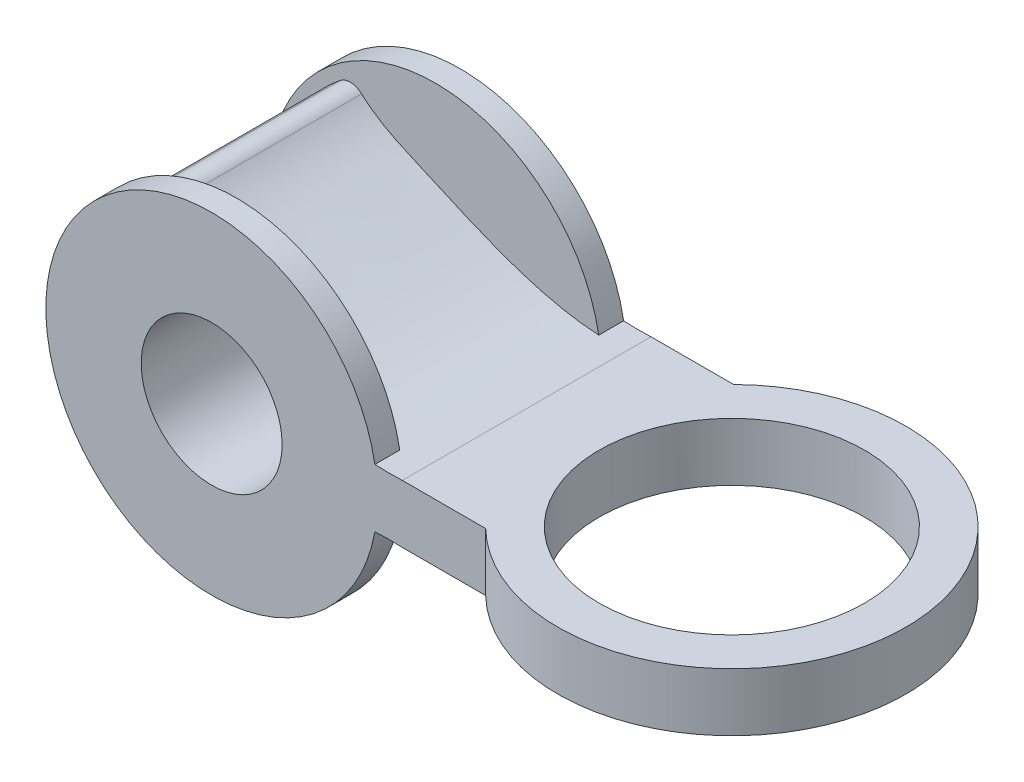
from build123d import *

# Parameters (mm, degrees)
SKETCH1_R           = 20
BOSS_EXTRUDE1_DEPTH = 3
BOSS_EXTRUDE2_DEPTH = 30
FILLET1_R           = 2
SKETCH3_R           = 21
BOSS_EXTRUDE3_DEPTH = 7
BOSS_EXTRUDE4_START = -3
SKETCH4_R           = 20
BOSS_EXTRUDE4_DEPTH = 3
SKETCH5_R           = 8.5
CUT_EXTRUDE1_DEPTH  = 43
SKETCH6_R           = 16
CUT_EXTRUDE2_DEPTH  = 43


with BuildPart() as part:
    # Sketch1 → Boss-Extrude1 (new body)
    with BuildSketch(Plane.XY):
        Circle(SKETCH1_R)
    extrude(amount=-BOSS_EXTRUDE1_DEPTH)

    # Sketch2 → Boss-Extrude2 (add)
    with BuildSketch(Plane.XY):
        with BuildLine():
            Line((22.995189637, 3.5), (35.372983102, 3.5))
            Line((35.372983102, 3.5), (35.372983102, -3.5))
            Line((35.372983102, -3.5), (22.995189637, -3.5))
            add(Edge.make_bspline(
                [(-10.012259603, -15.596019766), (-7.820118135, -12.904569359), (3.188583593, -8.31405085), (13.833155486, -3.052585892), (22.995189637, -3.5)],
                knots=[0, 0, 0, 0, 0.276488418, 1, 1, 1, 1], degree=3))
            ThreePointArc((-10.012259603, -15.596019766), (-18.533245126, 0), (-10.012259603, 15.596019766))
            add(Edge.make_bspline(
                [(-10.012259603, 15.596019766), (-7.820118135, 12.904569359), (3.188583593, 8.31405085), (13.833155486, 3.052585892), (22.995189637, 3.5)],
                knots=[0, 0, 0, 0, 0.276488418, 1, 1, 1, 1], degree=3))
        make_face()
    extrude(amount=-BOSS_EXTRUDE2_DEPTH)

    # Fillet1
    fillet1_edges = [part.edges().sort_by_distance(p)[0] for p in [
        (-10.012259603, 15.596019766, -16.5),
        (-10.012259603, -15.596019766, -16.5),
    ]]
    fillet(fillet1_edges, radius=FILLET1_R)

    # Sketch3 → Boss-Extrude3 (add)
    with BuildSketch(Plane.XZ.offset(3.5)):
        with Locations((47.699784797, -15.04571332)):
            Circle(SKETCH3_R)
    extrude(amount=-BOSS_EXTRUDE3_DEPTH)

    # Sketch4 → Boss-Extrude4 (add)
    with BuildSketch(Plane(origin=(0, 0, -30), x_dir=(-1, 0, 0), z_dir=(0, 0, -1)).offset(BOSS_EXTRUDE4_START)):
        Circle(SKETCH4_R)
    extrude(amount=BOSS_EXTRUDE4_DEPTH)

    # Sketch5 → Cut-Extrude1 (cut)
    with BuildSketch(Plane.XY):
        Circle(SKETCH5_R)
    extrude(amount=-CUT_EXTRUDE1_DEPTH, mode=Mode.SUBTRACT)

    # Sketch6 → Cut-Extrude2 (cut)
    with BuildSketch(Plane.XZ.offset(3.5)):
        with Locations((47.699784797, -15.04571332)):
            Circle(SKETCH6_R)
    extrude(amount=-CUT_EXTRUDE2_DEPTH, mode=Mode.SUBTRACT)


solid = part.part
